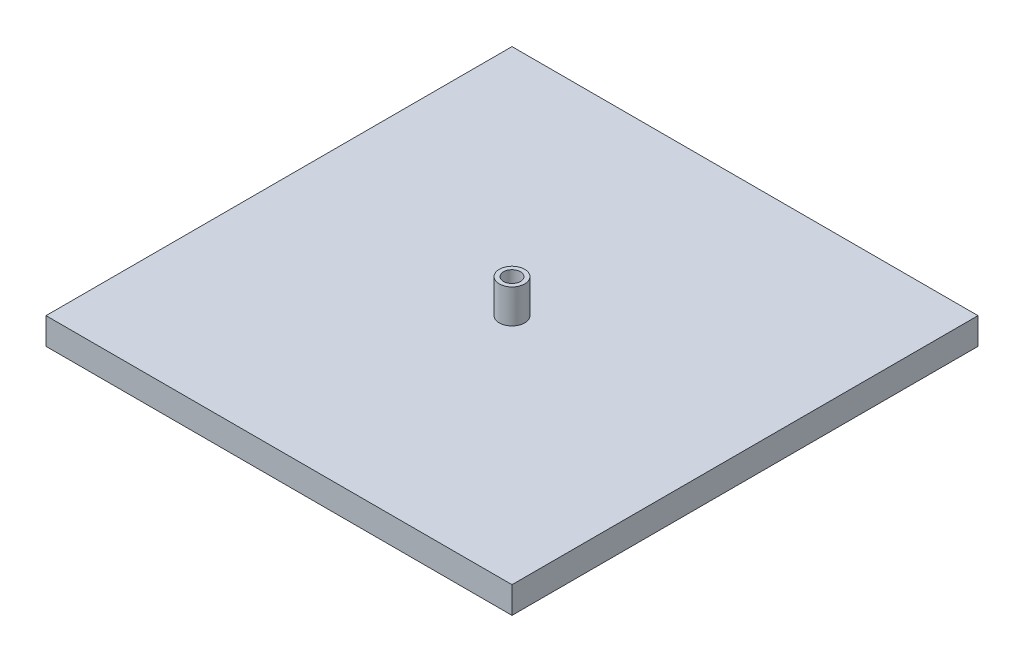
from build123d import *

# Parameters (mm, degrees)
SKETCH2_W           = 350
SKETCH2_H           = 350
BOSS_EXTRUDE1_DEPTH = 20
SKETCH3_R           = 6.35
CUT_EXTRUDE1_DEPTH  = 496.37864306
BOSS_EXTRUDE2_START = 25.4
SKETCH3_3_R         = 9.525
SKETCH3_3_R_2       = 6.35
BOSS_EXTRUDE2_DEPTH = 25.4


with BuildPart() as part:
    # Sketch2 → Boss-Extrude1 (new body)
    with BuildSketch(Plane(origin=(0, 0, 0), x_dir=(1, 0, 0), z_dir=(0, 1, 0))):
        with Locations((175, 175)):
            Rectangle(SKETCH2_W, SKETCH2_H)
    extrude(amount=BOSS_EXTRUDE1_DEPTH)

    # Sketch3 → Cut-Extrude1 (cut, through all)
    with BuildSketch(Plane(origin=(0, 20, 0), x_dir=(1, 0, 0), z_dir=(0, 1, 0))):
        with Locations((175, 175)):
            Circle(SKETCH3_R)
    extrude(amount=-CUT_EXTRUDE1_DEPTH, mode=Mode.SUBTRACT)

    # Sketch3<3> → Boss-Extrude2 (add)
    with BuildSketch(Plane(origin=(0, 20, 0), x_dir=(1, 0, 0), z_dir=(0, 1, 0)).offset(BOSS_EXTRUDE2_START)):
        with Locations((175, 175)):
            Circle(SKETCH3_3_R)
        with Locations((175, 175)):
            Circle(SKETCH3_3_R_2, mode=Mode.SUBTRACT)
    extrude(amount=-BOSS_EXTRUDE2_DEPTH)


solid = part.part
